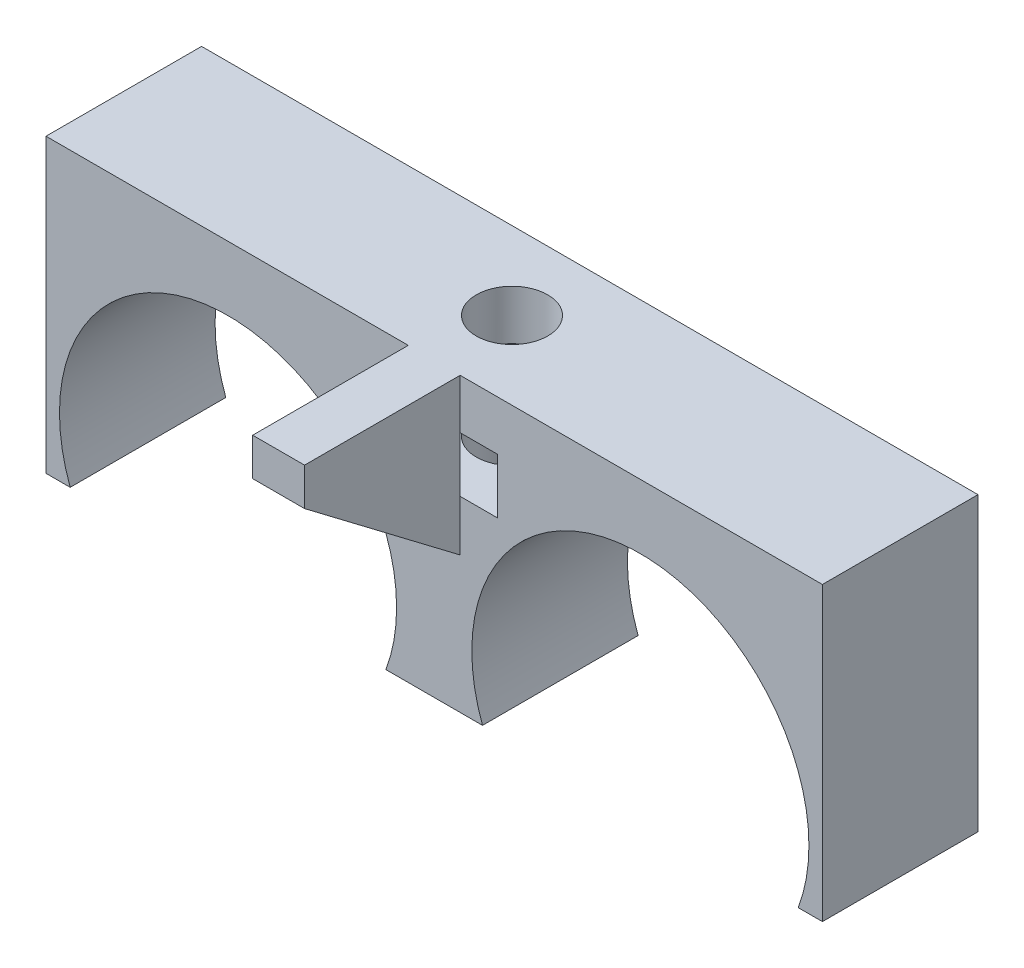
from build123d import *

# Parameters (mm, degrees)
BOSS_EXTRUDE1_DEPTH     = 7.619999999999999
CUT_EXTRUDE1_DEPTH      = 1.143
CUT_EXTRUDE1_DEPTH_BACK = 8
CUT_EXTRUDE2_DEPTH      = 7.619999999999999
BOSS_EXTRUDE2_START     = 1.143
SKETCH4_W               = 38.023799999999994
SKETCH4_H               = 7.619999999999999
SKETCH4_R               = 1.75
BOSS_EXTRUDE2_DEPTH     = 1.143
BOSS_EXTRUDE3_DEPTH     = 7.619999999999999
CUT_EXTRUDE3_DEPTH      = 7.619999999999999


with BuildPart() as part:
    # Sketch1 → Boss-Extrude1 (new body)
    with BuildSketch(Plane.XY):
        with BuildLine():
            ThreePointArc((-8.61622105177378, 6.7818000000000005), (-16.346714285714288, 17.932399999999998), (-24.077207519654795, 6.781800000000001))
            Line((-24.077207519654795, 6.781800000000001), (-24.88111428571429, 6.781800000000001))
            Line((-24.88111428571429, 6.781800000000001), (-24.88111428571429, 19.558000000000003))
            Line((-24.88111428571429, 19.558000000000003), (12.380685714285711, 19.558000000000003))
            Line((12.380685714285711, 19.558000000000003), (12.380685714285711, 6.7818000000000005))
            Line((12.380685714285711, 6.7818000000000005), (11.576778948226218, 6.7818000000000005))
            ThreePointArc((11.576778948226218, 6.7818000000000005), (3.846285714285714, 17.932399999999994), (-3.8842075196547947, 6.7818000000000005))
            Line((-3.8842075196547947, 6.7818000000000005), (-8.61622105177378, 6.7818000000000005))
        make_face()
        Polygon((12.380685714285711, 6.7818000000000005), (12.76168571428571, 6.781800000000001), (12.76168571428571, 19.939000000000004), (-25.262114285714286, 19.939000000000004), (-25.262114285714286, 6.781800000000001), (-24.88111428571429, 6.781800000000001), (-24.88111428571429, 19.558000000000003), (12.380685714285711, 19.558000000000003), align=None)
    extrude(amount=BOSS_EXTRUDE1_DEPTH)

    # Sketch2 → Cut-Extrude1 (cut, two sides: drawn at the far end of the back side and taken through both)
    with BuildSketch(Plane(origin=(0, 19.939000000000004, 0), x_dir=(1, 0, 0), z_dir=(0, 1, 0)).offset(-CUT_EXTRUDE1_DEPTH_BACK)):
        with BuildLine():
            ThreePointArc((-6.250214285714273, -2.0600000000000005), (-8.00021428571429, -3.8100000000000005), (-6.250214285714274, -5.5600000000000005))
            Line((-6.250214285714289, -5.5600000000000005), (-6.250214285714289, -2.0600000000000005))
        make_face()
        with BuildLine():
            Line((-6.250214285714289, -2.0600000000000005), (-6.250214285714289, -5.5600000000000005))
            ThreePointArc((-6.250214285714274, -5.5600000000000005), (-5.012777418637826, -5.047436867076454), (-4.500214285714289, -3.810000000000001))
            ThreePointArc((-4.500214285714289, -3.8100000000000005), (-5.0127774186378256, -2.5725631329235483), (-6.250214285714273, -2.0600000000000005))
        make_face()
    extrude(amount=CUT_EXTRUDE1_DEPTH + CUT_EXTRUDE1_DEPTH_BACK, mode=Mode.SUBTRACT)

    # Sketch3 → Cut-Extrude2 (cut)
    with BuildSketch(Plane.XY.offset(7.619999999999999)):
        Polygon((-9.350214285713994, 15.948293112068052), (-3.1502142857139956, 15.948293112068052), (-3.150214285713995, 18.64829304606805), (-9.350214285713994, 18.64829304606805), align=None)
    extrude(amount=-CUT_EXTRUDE2_DEPTH, mode=Mode.SUBTRACT)

    # Sketch4 → Boss-Extrude2 (add)
    with BuildSketch(Plane(origin=(0, 19.939000000000004, 0), x_dir=(1, 0, 0), z_dir=(0, 1, 0)).offset(BOSS_EXTRUDE2_START)):
        with Locations((-6.250214285714288, -3.8099999999999996)):
            Rectangle(SKETCH4_W, SKETCH4_H)
        with Locations(Location((-6.250214285714289, -3.8100000000000005, 0), (0, 0, 90))):
            Circle(SKETCH4_R, mode=Mode.SUBTRACT)
    extrude(amount=-BOSS_EXTRUDE2_DEPTH)

    # Sketch5 → Boss-Extrude3 (add)
    with BuildSketch(Plane.XY.offset(7.619999999999999)):
        Polygon((-7.520214285714289, 21.082000000000004), (-4.980214285714288, 21.082000000000004), (-4.980214285714287, 13.462000000000005), (-7.520214285714288, 13.462000000000005), align=None)
    extrude(amount=BOSS_EXTRUDE3_DEPTH)

    # Sketch6 → Cut-Extrude3 (cut)
    with BuildSketch(Plane(origin=(-4.980214285714286, -5.7e-16, 0), x_dir=(0, 0, -1), z_dir=(1, 1.1e-16, 0))):
        Polygon((-15.239999999999998, 13.462000000000005), (-7.619999999999999, 13.462000000000005), (-15.239999999999998, 19.238462155748426), align=None)
    extrude(amount=-CUT_EXTRUDE3_DEPTH, mode=Mode.SUBTRACT)


solid = part.part
